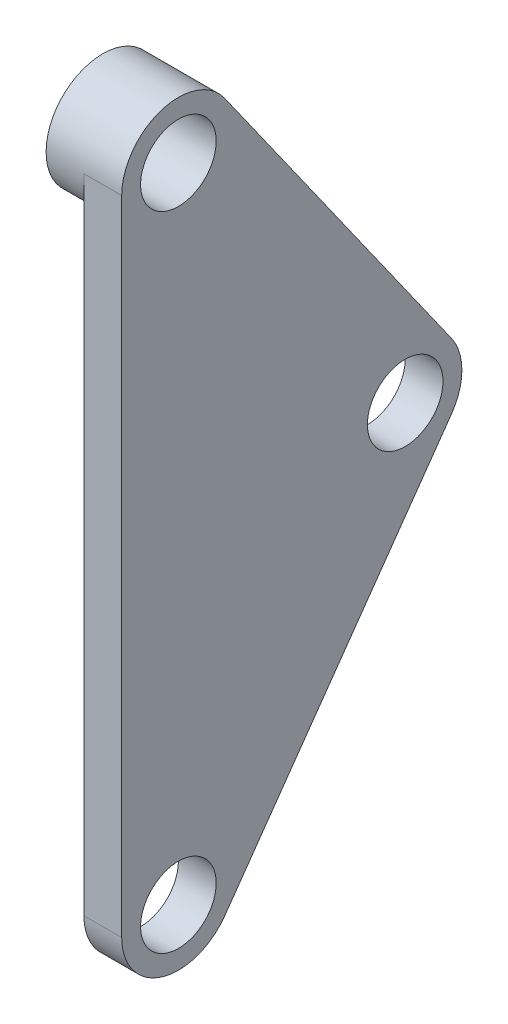
from build123d import *

# Parameters (mm, degrees)
EXTRUDE_1_DEPTH          = 2
EXTRUDE_START            = -2
SKETCH_1_4_R             = 3
EXTRUDE_2_DEPTH          = 2
CUT_EXTRUDE_1_DEPTH      = 44.9089968
CUT_EXTRUDE_1_DEPTH_BACK = 44.9089968
SKETCH_1_3_R             = 2


with BuildPart() as part:
    # 草图1 → 凸台-拉伸1 (new body)
    with BuildSketch(Plane(origin=(0, 0, 0), x_dir=(0, 0, -1), z_dir=(1, 0, 0))):
        with BuildLine():
            Line((17.45090359, -18.269950407), (5.45090359, -1.269950407))
            ThreePointArc((5.45090359, -1.269950407), (2.092451315, -0.140567297), (0, -3))
            Line((0, -3), (0, -37))
            ThreePointArc((0, -37), (2.092451315, -39.859432703), (5.45090359, -38.730049593))
            Line((5.45090359, -38.730049593), (17.45090359, -21.730049593))
            ThreePointArc((17.45090359, -21.730049593), (18, -20), (17.45090359, -18.269950407))
        make_face()
    extrude(amount=EXTRUDE_1_DEPTH)

    # 草图1<4> → 凸台-拉伸2 (add)
    with BuildSketch(Plane(origin=(0, 0, 0), x_dir=(0, 0, -1), z_dir=(1, 0, 0)).offset(EXTRUDE_START)):
        with Locations((3, -3)):
            Circle(SKETCH_1_4_R)
    extrude(amount=EXTRUDE_2_DEPTH)

    # 草图1<3> → 切除-拉伸1 (cut, two sides: drawn at the far end of the back side and taken through both)
    with BuildSketch(Plane(origin=(0, 0, 0), x_dir=(0, 0, -1), z_dir=(1, 0, 0)).offset(-CUT_EXTRUDE_1_DEPTH_BACK)):
        with Locations((3, -3)):
            Circle(SKETCH_1_3_R)
        with Locations((15, -20)):
            Circle(SKETCH_1_3_R)
        with Locations((3, -37)):
            Circle(SKETCH_1_3_R)
    extrude(amount=CUT_EXTRUDE_1_DEPTH + CUT_EXTRUDE_1_DEPTH_BACK, mode=Mode.SUBTRACT)


solid = part.part
